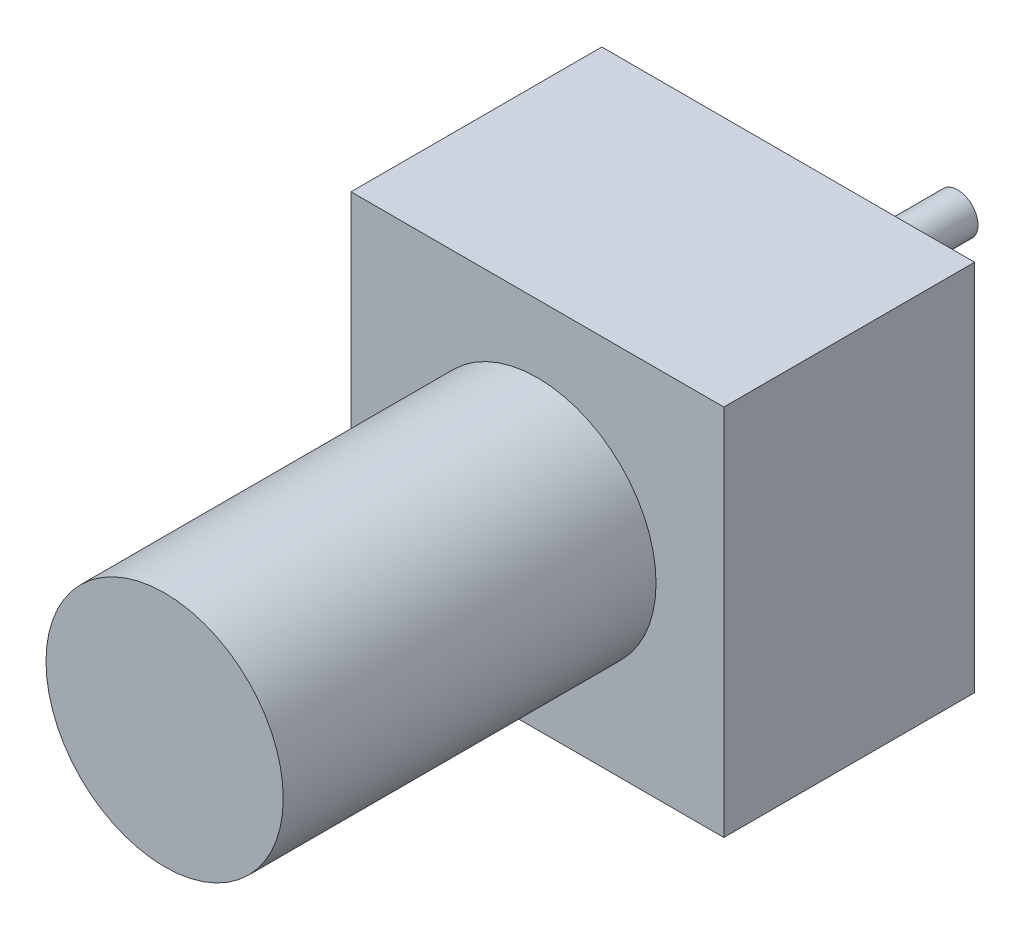
from build123d import *

# Parameters (mm, degrees)
SKETCH1_W           = 55
SKETCH1_H           = 55
BOSS_EXTRUDE1_DEPTH = 37
SKETCH2_R           = 17.5
BOSS_EXTRUDE2_DEPTH = 55
SKETCH3_R           = 3
BOSS_EXTRUDE3_DEPTH = 25


with BuildPart() as part:
    # Sketch1 → Boss-Extrude1 (new body)
    with BuildSketch(Plane.XY):
        Rectangle(SKETCH1_W, SKETCH1_H)
    extrude(amount=BOSS_EXTRUDE1_DEPTH)

    # Sketch2 → Boss-Extrude2 (add)
    with BuildSketch(Plane.XY.offset(37)):
        Circle(SKETCH2_R)
    extrude(amount=BOSS_EXTRUDE2_DEPTH)

    # Sketch3 → Boss-Extrude3 (add)
    with BuildSketch(Plane(origin=(0, 0, 0), x_dir=(-1, 0, 0), z_dir=(0, 0, -1))):
        with Locations(Location((0, 7.5, 0), (0, 0, 180))):
            Circle(SKETCH3_R)
    extrude(amount=BOSS_EXTRUDE3_DEPTH)


solid = part.part
